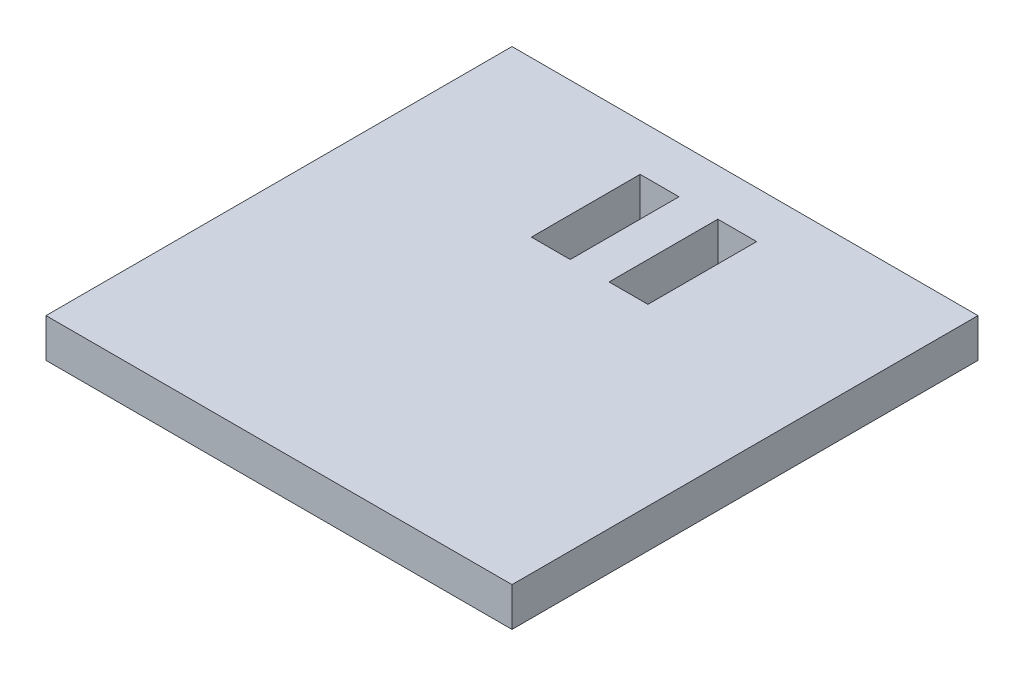
from build123d import *

# Parameters (mm, degrees)
SKETCH1_W           = 38.1
SKETCH1_H           = 38.1
SKETCH1_W_2         = 3.175
SKETCH1_H_2         = 8.89
BOSS_EXTRUDE1_DEPTH = 3.175


with BuildPart() as part:
    # Sketch1 → Boss-Extrude1 (new body)
    with BuildSketch(Plane(origin=(0, 0, 0), x_dir=(1, 0, 0), z_dir=(0, 1, 0))):
        with Locations((19.05, 19.05)):
            Rectangle(SKETCH1_W, SKETCH1_H)
        with Locations((15.875, 29.845)):
            Rectangle(SKETCH1_W_2, SKETCH1_H_2, mode=Mode.SUBTRACT)
        with Locations((22.225, 29.845)):
            Rectangle(SKETCH1_W_2, SKETCH1_H_2, mode=Mode.SUBTRACT)
    extrude(amount=BOSS_EXTRUDE1_DEPTH)


solid = part.part
